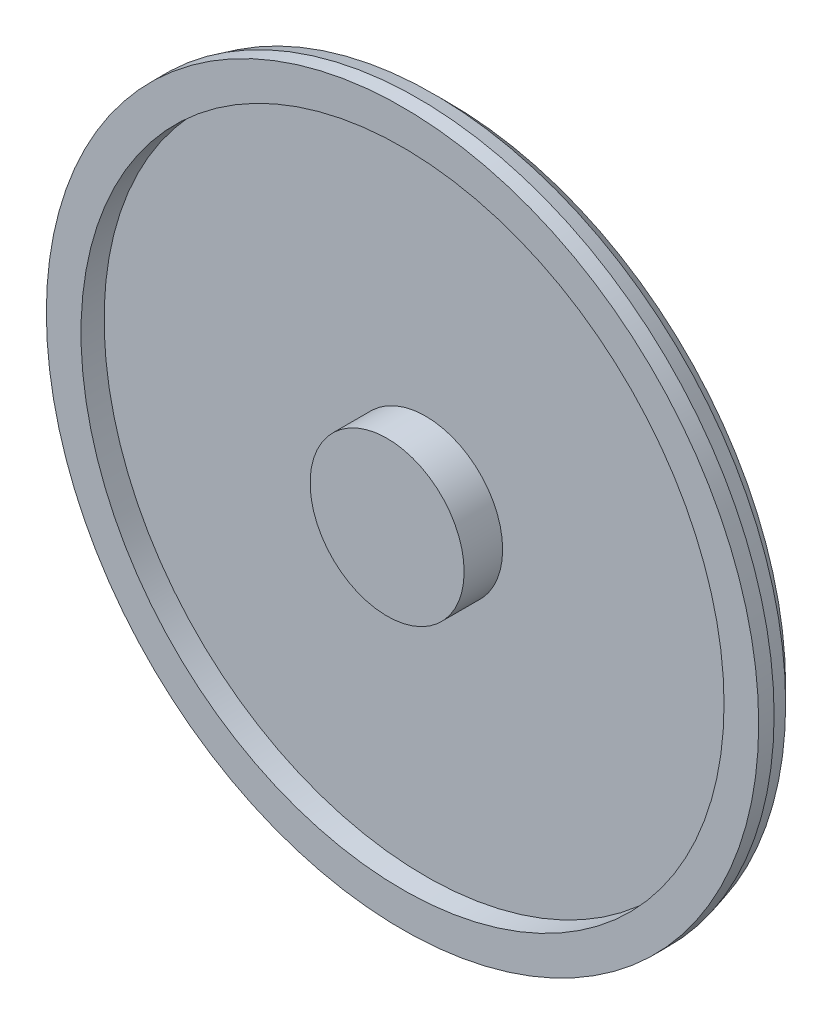
from build123d import *


with BuildPart() as part:
    # Sketch1 → Revolve1 (revolve)
    with BuildSketch(Plane(origin=(0, 0, 0), x_dir=(0, 0, -1), z_dir=(1, 0, 0)), mode=Mode.PRIVATE) as revolve1_sk:
        Polygon((0, 0), (0, 100), (50, 100), (50, 417.5), (20, 417.5), (20, 462.5), (40, 462.5), (60.490381057, 457.009618943), (80, 437.5), (80, 0), align=None)
    revolve(revolve1_sk.sketch.rotate(Axis((0, 0, 404.979253112), (0, 0, -1)), 90), axis=Axis((0, 0, 404.979253112), (0, 0, -1)))


solid = part.part
